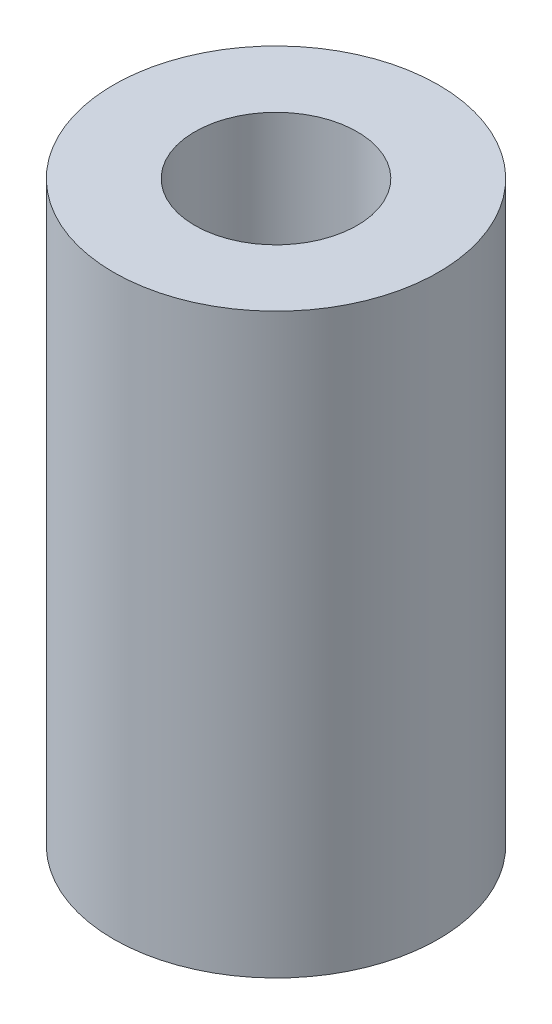
from build123d import *

# Parameters (mm, degrees)
SKETCH_1_R      = 4.5
SKETCH_1_R_2    = 2.25
EXTRUDE_1_DEPTH = 8


with BuildPart() as part:
    # Эскиз1 → Бобышка-Вытянуть1 (new, symmetric)
    with BuildSketch(Plane(origin=(0, 0, 0), x_dir=(1, 0, 0), z_dir=(0, 1, 0))):
        with Locations(Location((0, 0, 0), (0, 0, 270))):
            Circle(SKETCH_1_R)
        with Locations(Location((0, 0, 0), (0, 0, 270))):
            Circle(SKETCH_1_R_2, mode=Mode.SUBTRACT)
    extrude(amount=EXTRUDE_1_DEPTH, both=True)


solid = part.part
